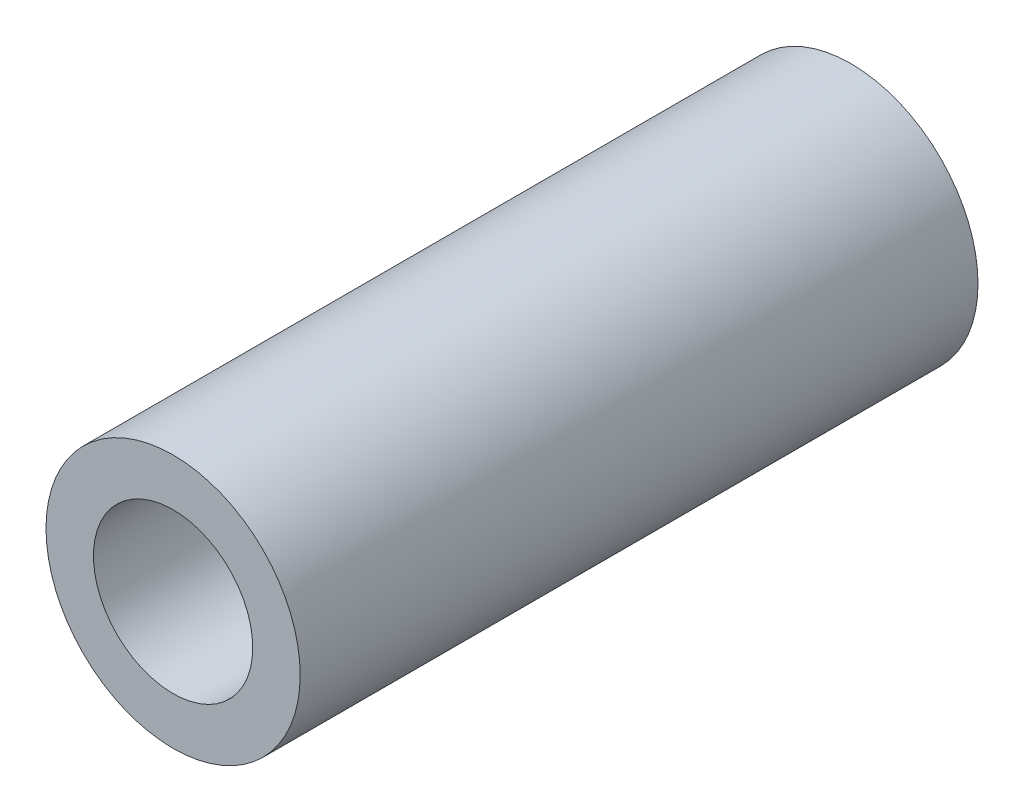
from build123d import *

# Parameters (mm, degrees)
SKETCH1_R           = 4.7625
SKETCH1_R_2         = 2.9845
BOSS_EXTRUDE1_DEPTH = 25.4


with BuildPart() as part:
    # Sketch1 → Boss-Extrude1 (new body)
    with BuildSketch(Plane.XY):
        Circle(SKETCH1_R)
        Circle(SKETCH1_R_2, mode=Mode.SUBTRACT)
    extrude(amount=BOSS_EXTRUDE1_DEPTH)


solid = part.part
